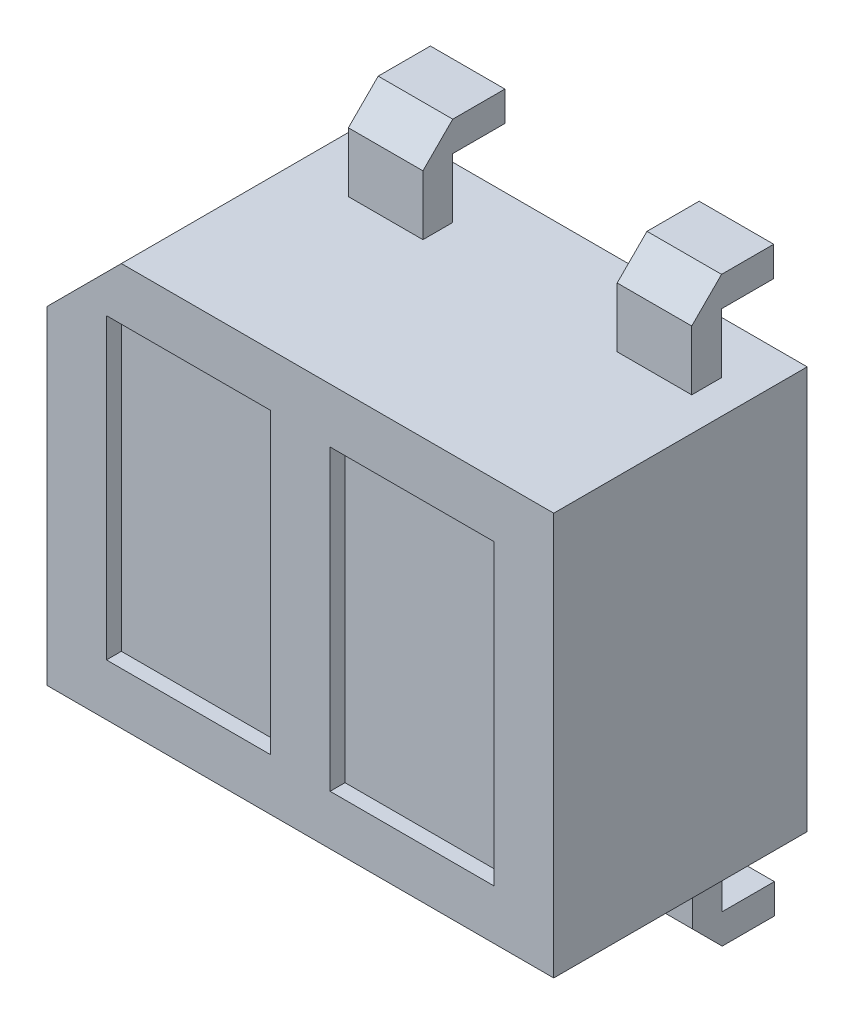
from build123d import *

# Parameters (mm, degrees)
SKICA1_W                 = 3.4
SKICA1_H                 = 2.7
P_IDAT_VYSUNUT_M1_DEPTH  = 1.7
SKICA2_W                 = 1.1
SKICA2_H                 = 2
ODEBRAT_VYSUNUT_M2_DEPTH = 0.1
ODEBRAT_VYSUNUT_M4_DEPTH = 3.757263136
SKICA5_W                 = 0.5
SKICA5_H                 = 0.2
P_IDAT_VYSUNUT_M2_DEPTH  = 0.6
SKICA6_W                 = 0.5
SKICA6_H                 = 0.2
P_IDAT_VYSUNUT_M3_DEPTH  = 0.35
ZKOSEN_2_SIZE            = 0.2
SKICA8_W                 = 0.5
SKICA8_H                 = 0.2
P_IDAT_VYSUNUT_M4_DEPTH  = 0.6
SKICA9_W                 = 0.5
SKICA9_H                 = 0.2
P_IDAT_VYSUNUT_M5_DEPTH  = 0.35
ZKOSEN_3_SIZE            = 0.2


with BuildPart() as part:
    # Skica1 → Přidat vysunutím1 (new body)
    with BuildSketch(Plane.XY):
        Rectangle(SKICA1_W, SKICA1_H)
    extrude(amount=P_IDAT_VYSUNUT_M1_DEPTH)

    # Skica2 → Odebrat vysunutím2 (cut)
    with BuildSketch(Plane.XY.offset(1.7)):
        with Locations((-0.75, -0.002377928)):
            Rectangle(SKICA2_W, SKICA2_H)
        with Locations((0.75, -0.015526056)):
            Rectangle(SKICA2_W, SKICA2_H)
    extrude(amount=-ODEBRAT_VYSUNUT_M2_DEPTH, mode=Mode.SUBTRACT)

    # Skica4 → Odebrat vysunutím4 (cut, through all)
    with BuildSketch(Plane.XY.offset(1.7)):
        Polygon((-1.7, 0.85), (-1.2, 1.35), (-1.7, 1.35), align=None)
    extrude(amount=-ODEBRAT_VYSUNUT_M4_DEPTH, mode=Mode.SUBTRACT)

    # Skica5 → Přidat vysunutím2 (add)
    with BuildSketch(Plane(origin=(0, 1.35, 0), x_dir=(1, 0, 0), z_dir=(0, 1, 0))):
        with Locations((1.22555684, -0.45)):
            Rectangle(SKICA5_W, SKICA5_H)
        with Locations((-0.577330956, -0.45)):
            Rectangle(SKICA5_W, SKICA5_H)
    extrude(amount=P_IDAT_VYSUNUT_M2_DEPTH)

    # Skica6 → Přidat vysunutím3 (add)
    with BuildSketch(Plane(origin=(0, 0, 0.35), x_dir=(-1, 0, 0), z_dir=(0, 0, -1))):
        with Locations((-1.22555684, 1.85)):
            Rectangle(SKICA6_W, SKICA6_H)
        with Locations((0.577330956, 1.85)):
            Rectangle(SKICA6_W, SKICA6_H)
    extrude(amount=P_IDAT_VYSUNUT_M3_DEPTH)

    # Zkosení2
    zkosen_2_edges = [part.edges().sort_by_distance(p)[0] for p in [
        (1.22555684, 1.95, 0.55),
        (-0.577330956, 1.95, 0.55),
    ]]
    chamfer(zkosen_2_edges, length=ZKOSEN_2_SIZE)

    # Skica8 → Přidat vysunutím4 (add)
    with BuildSketch(Plane.XZ.offset(1.35)):
        with Locations((1.23, 0.45)):
            Rectangle(SKICA8_W, SKICA8_H)
        with Locations((-0.57, 0.45)):
            Rectangle(SKICA8_W, SKICA8_H)
    extrude(amount=P_IDAT_VYSUNUT_M4_DEPTH)

    # Skica9 → Přidat vysunutím5 (add)
    with BuildSketch(Plane(origin=(0, 0, 0.35), x_dir=(-1, 0, 0), z_dir=(0, 0, -1))):
        with Locations((-1.23, -1.85)):
            Rectangle(SKICA9_W, SKICA9_H)
        with Locations((0.57, -1.85)):
            Rectangle(SKICA9_W, SKICA9_H)
    extrude(amount=P_IDAT_VYSUNUT_M5_DEPTH)

    # Zkosení3
    zkosen_3_edges = [part.edges().sort_by_distance(p)[0] for p in [
        (1.23, -1.95, 0.55),
        (-0.57, -1.95, 0.55),
    ]]
    chamfer(zkosen_3_edges, length=ZKOSEN_3_SIZE)


solid = part.part
